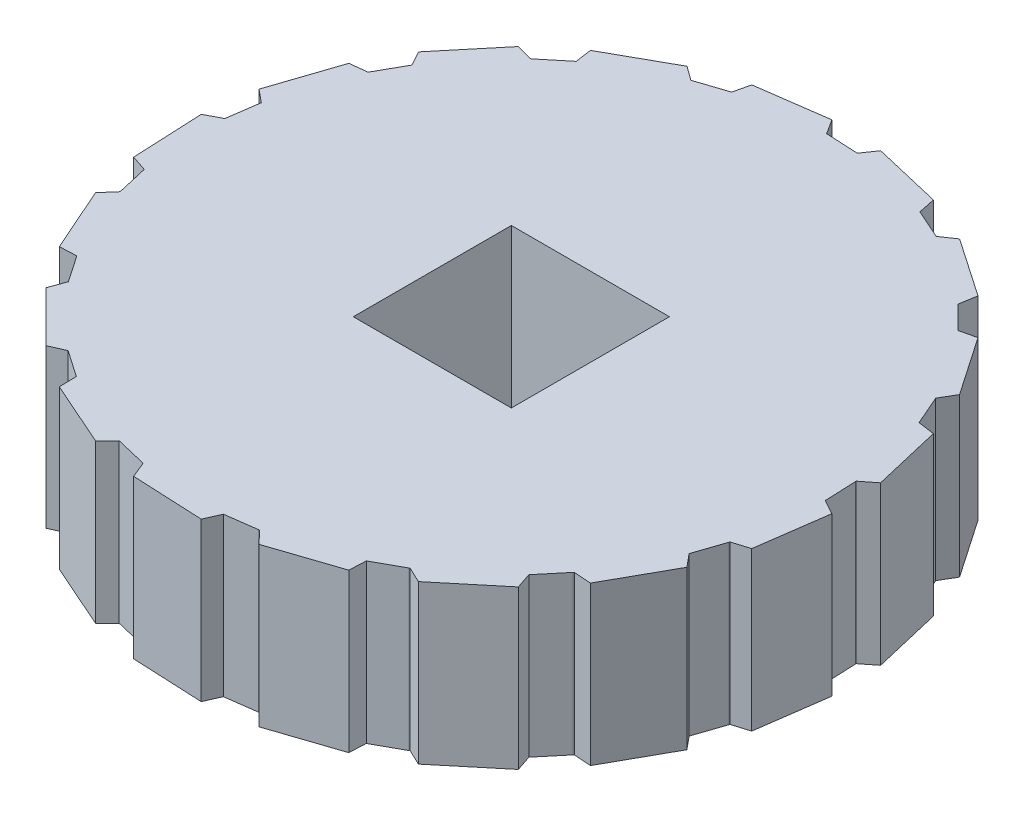
from build123d import *

# Parameters (mm, degrees)
BELT_PULLEY_W       = 6.35
BELT_PULLEY_H       = 6.35
BOSS_EXTRUDE1_DEPTH = 6.35


with BuildPart() as part:
    # Belt Pulley → Boss-Extrude1 (new body)
    with BuildSketch(Plane(origin=(0, 0, 0), x_dir=(1, 0, 0), z_dir=(0, 1, 0))):
        with BuildLine():
            Line((1.26, 12.637341493), (0, 12.7))
            ThreePointArc((0, 12.7), (-0.016303366, 12.699989535), (-0.032606705, 12.699958142))
            Line((-0.032606705, 12.699958142), (-0.41408034, 13.288550052))
            Line((-0.41408034, 13.288550052), (-3.23677354, 12.894972743))
            Line((-3.23677354, 12.894972743), (-3.390219288, 12.239134495))
            Line((-3.390219288, 12.239134495), (-4.587769161, 11.842397313))
            ThreePointArc((-4.587769161, 11.842397313), (-4.602967816, 11.8364981), (-4.618158887, 11.830579381))
            Line((-4.618158887, 11.830579381), (-5.18649638, 12.24162082))
            Line((-5.18649638, 12.24162082), (-7.676402878, 10.854946515))
            Line((-7.676402878, 10.854946515), (-7.582570675, 10.187964564))
            Line((-7.582570675, 10.187964564), (-8.555934674, 9.385413249))
            ThreePointArc((-8.555934674, 9.385413249), (-8.567975957, 9.374422009), (-8.58000312, 9.36341532))
            Line((-8.58000312, 9.36341532), (-9.258447344, 9.541392864))
            Line((-9.258447344, 9.541392864), (-11.079291471, 7.348899611))
            Line((-11.079291471, 7.348899611), (-10.750853876, 6.760853565))
            Line((-10.750853876, 6.760853565), (-11.3685738, 5.660877118))
            ThreePointArc((-11.3685738, 5.660877118), (-11.375831468, 5.646278279), (-11.383070389, 5.631670135))
            Line((-11.383070389, 5.631670135), (-12.079993691, 5.55254693))
            Line((-12.079993691, 5.55254693), (-12.985860359, 2.850343093))
            Line((-12.985860359, 2.850343093), (-12.467174689, 2.42065183))
            Line((-12.467174689, 2.42065183), (-12.645824039, 1.171808165))
            ThreePointArc((-12.645824039, 1.171808165), (-12.647317904, 1.155573381), (-12.648790926, 1.139336692))
            Line((-12.648790926, 1.139336692), (-13.270069953, 0.813798767))
            Line((-13.270069953, 0.813798767), (-13.138616847, -2.033168055))
            Line((-13.138616847, -2.033168055), (-12.499734477, -2.246472349))
            Line((-12.499734477, -2.246472349), (-12.215185668, -3.475519974))
            ThreePointArc((-12.215185668, -3.475519974), (-12.210713975, -3.491198106), (-12.20622216, -3.506870484))
            Line((-12.20622216, -3.506870484), (-12.667949736, -4.03485743))
            Line((-12.667949736, -4.03485743), (-11.516930327, -6.64208859))
            Line((-11.516930327, -6.64208859), (-10.84413586, -6.610197989))
            Line((-10.84413586, -6.610197989), (-10.134818786, -7.653459882))
            ThreePointArc((-10.134818786, -7.653459882), (-10.124985463, -7.666463943), (-10.115135453, -7.679455369))
            Line((-10.115135453, -7.679455369), (-10.354952711, -8.338583773))
            Line((-10.354952711, -8.338583773), (-8.339818549, -10.353958256))
            Line((-8.339818549, -10.353958256), (-7.723976606, -10.081179762))
            Line((-7.723976606, -10.081179762), (-6.685688469, -10.797757624))
            ThreePointArc((-6.685688469, -10.797757624), (-6.671821559, -10.806331343), (-6.657943654, -10.814887253))
            Line((-6.657943654, -10.814887253), (-6.643461944, -11.516138172))
            Line((-6.643461944, -11.516138172), (-4.036368063, -12.667468487))
            Line((-4.036368063, -12.667468487), (-3.560651511, -12.190642346))
            Line((-3.560651511, -12.190642346), (-2.333618876, -12.483758366))
            ThreePointArc((-2.333618876, -12.483758366), (-2.317591183, -12.486743815), (-2.301559671, -12.489708687))
            Line((-2.301559671, -12.489708687), (-2.034734829, -13.138374297))
            Line((-2.034734829, -13.138374297), (0.812216296, -13.270166905))
            Line((0.812216296, -13.270166905), (1.0835593, -12.653691131))
            Line((1.0835593, -12.653691131), (2.333618876, -12.483758366))
            ThreePointArc((2.333618876, -12.483758366), (2.349642724, -12.480752344), (2.365662699, -12.477725754))
            Line((2.365662699, -12.477725754), (2.8487945, -12.986200172))
            Line((2.8487945, -12.986200172), (5.551106344, -12.08065575))
            Line((5.551106344, -12.08065575), (5.581429424, -11.407788812))
            Line((5.581429424, -11.407788812), (6.685688469, -10.797757624))
            ThreePointArc((6.685688469, -10.797757624), (6.699544361, -10.78916611), (6.713389212, -10.780556817))
            Line((6.713389212, -10.780556817), (7.347578346, -11.080167754))
            Line((7.347578346, -11.080167754), (9.54028872, -9.259585095))
            Line((9.54028872, -9.259585095), (9.325496576, -8.621201402))
            Line((9.325496576, -8.621201402), (10.134818786, -7.653459882))
            ThreePointArc((10.134818786, -7.653459882), (10.144635409, -7.640443209), (10.154435313, -7.627413944))
            Line((10.154435313, -7.627413944), (10.854031022, -7.677697283))
            Line((10.854031022, -7.677697283), (12.24100224, -5.187956164))
            Line((12.24100224, -5.187956164), (11.810103742, -4.67027297))
            Line((11.810103742, -4.67027297), (12.215185668, -3.475519974))
            ThreePointArc((12.215185668, -3.475519974), (12.219637231, -3.459836115), (12.224068656, -3.444146554))
            Line((12.224068656, -3.444146554), (12.894586664, -3.238311251))
            Line((12.894586664, -3.238311251), (13.288500578, -0.415665006))
            Line((13.288500578, -0.415665006), (12.699690955, -0.088598295))
            Line((12.699690955, -0.088598295), (12.645824039, 1.171808165))
            ThreePointArc((12.645824039, 1.171808165), (12.644309334, 1.188041018), (12.642773792, 1.204271914))
            Line((12.642773792, 1.204271914), (13.193656926, 1.638426659))
            Line((13.193656926, 1.638426659), (12.541313278, 4.412764015))
            Line((12.541313278, 4.412764015), (11.874114533, 4.505042071))
            Line((11.874114533, 4.505042071), (11.3685738, 5.660877118))
            ThreePointArc((11.3685738, 5.660877118), (11.361297397, 5.675466629), (11.354002271, 5.690046786))
            Line((11.354002271, 5.690046786), (11.710850711, 6.293885971))
            Line((11.710850711, 6.293885971), (10.100352127, 8.645224804))
            Line((10.100352127, 8.645224804), (9.444873147, 8.490251542))
            Line((9.444873147, 8.490251542), (8.555934674, 9.385413249))
            ThreePointArc((8.555934674, 9.385413249), (8.543879292, 9.396389022), (8.531809829, 9.40734931))
            Line((8.531809829, 9.40734931), (8.646429216, 10.099321106))
            Line((8.646429216, 10.099321106), (6.295282453, 11.710100078))
            Line((6.295282453, 11.710100078), (5.740049306, 11.328805496))
            Line((5.740049306, 11.328805496), (4.587769161, 11.842397313))
            ThreePointArc((4.587769161, 11.842397313), (4.572562944, 11.848277011), (4.557349193, 11.854137182))
            Line((4.557349193, 11.854137182), (4.414259544, 12.540786964))
            Line((4.414259544, 12.540786964), (1.64, 13.193461449))
            Line((1.64, 13.193461449), (1.26, 12.637341493))
        make_face()
        Rectangle(BELT_PULLEY_W, BELT_PULLEY_H, mode=Mode.SUBTRACT)
    extrude(amount=BOSS_EXTRUDE1_DEPTH)


solid = part.part
